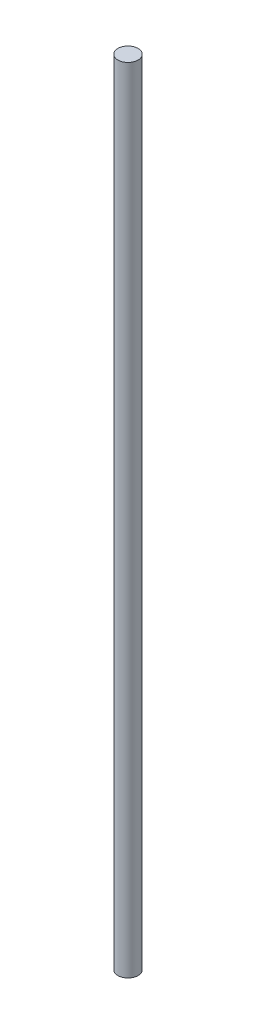
from build123d import *

# Parameters (mm, degrees)
SKETCH1_R           = 1.525
BOSS_EXTRUDE1_DEPTH = 120


with BuildPart() as part:
    # Sketch1 → Boss-Extrude1 (new body)
    with BuildSketch(Plane(origin=(0, 0, 0), x_dir=(1, 0, 0), z_dir=(0, 1, 0))):
        with Locations(Location((0, 0, 0), (0, 0, 270))):
            Circle(SKETCH1_R)
    extrude(amount=BOSS_EXTRUDE1_DEPTH)


solid = part.part
